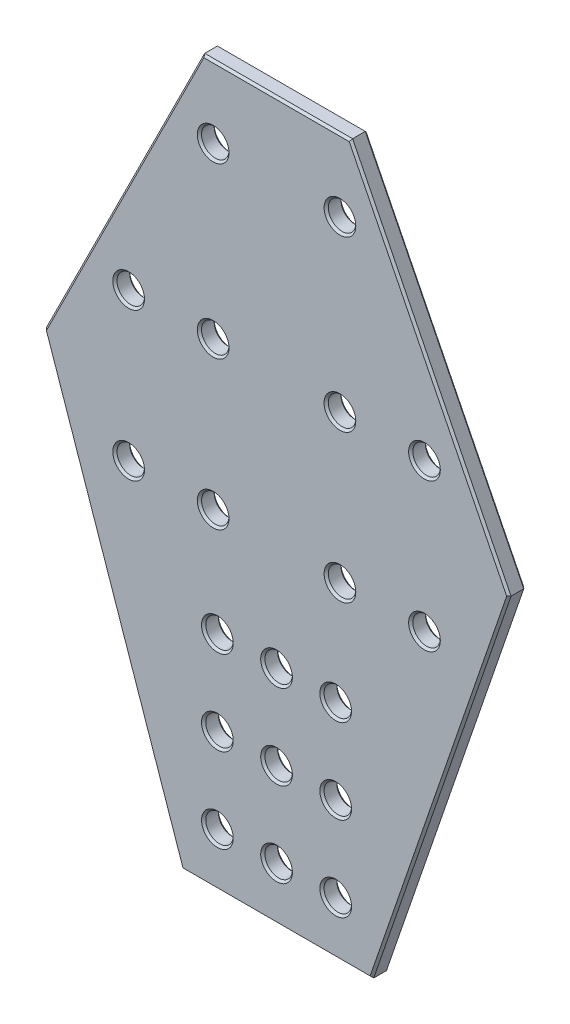
from build123d import *

# Parameters (mm, degrees)
SKETCH_1_R        = 13
EXTRUDE_874_DEPTH = 16
CHAMFER_1_SIZE    = 2


with BuildPart() as part:
    # 草图1 → Extrude 874 (new body)
    with BuildSketch(Plane.XY):
        Polygon((-70, 228), (70, 228), (220, -72), (90, -450), (-90, -450), (-220, -72), align=None)
        with Locations((-140, 0)):
            Circle(SKETCH_1_R, mode=Mode.SUBTRACT)
        with Locations((-60, 0)):
            Circle(SKETCH_1_R, mode=Mode.SUBTRACT)
        with Locations(Location((60, -140, 0), (0, 0, 180))):
            Circle(SKETCH_1_R, mode=Mode.SUBTRACT)
        with Locations(Location((140, -140, 0), (0, 0, 180))):
            Circle(SKETCH_1_R, mode=Mode.SUBTRACT)
        with Locations((-140, -140)):
            Circle(SKETCH_1_R, mode=Mode.SUBTRACT)
        with Locations((-60, -140)):
            Circle(SKETCH_1_R, mode=Mode.SUBTRACT)
        with Locations(Location((60, 0, 0), (0, 0, 180))):
            Circle(SKETCH_1_R, mode=Mode.SUBTRACT)
        with Locations(Location((140, 0, 0), (0, 0, 180))):
            Circle(SKETCH_1_R, mode=Mode.SUBTRACT)
        with Locations((0, -400)):
            Circle(SKETCH_1_R, mode=Mode.SUBTRACT)
        with Locations((0, -240)):
            Circle(SKETCH_1_R, mode=Mode.SUBTRACT)
        with Locations((60, 160)):
            Circle(SKETCH_1_R, mode=Mode.SUBTRACT)
        with Locations((0, -320)):
            Circle(SKETCH_1_R, mode=Mode.SUBTRACT)
        with Locations((-60, 160)):
            Circle(SKETCH_1_R, mode=Mode.SUBTRACT)
        with Locations((56, -240)):
            Circle(SKETCH_1_R, mode=Mode.SUBTRACT)
        with Locations((56, -320)):
            Circle(SKETCH_1_R, mode=Mode.SUBTRACT)
        with Locations((56, -400)):
            Circle(SKETCH_1_R, mode=Mode.SUBTRACT)
        with Locations(Location((-56, -400, 0), (0, 0, 180))):
            Circle(SKETCH_1_R, mode=Mode.SUBTRACT)
        with Locations(Location((-56, -320, 0), (0, 0, 180))):
            Circle(SKETCH_1_R, mode=Mode.SUBTRACT)
        with Locations(Location((-56, -240, 0), (0, 0, 180))):
            Circle(SKETCH_1_R, mode=Mode.SUBTRACT)
    extrude(amount=EXTRUDE_874_DEPTH)

    # 倒角1
    chamfer_1_edges = [part.edges().sort_by_distance(p)[0] for p in [
        (0, -450, 16),
        (155, -261, 16),
        (145, 78, 16),
        (-153, 0, 0),
        (-153, 0, 16),
        (0, 228, 16),
        (-73, 0, 0),
        (-73, 0, 16),
        (73, -140, 0),
        (73, -140, 16),
        (153, -140, 0),
        (153, -140, 16),
        (-153, -140, 0),
        (-153, -140, 16),
        (-73, -140, 0),
        (-73, -140, 16),
        (73, 0, 0),
        (73, 0, 16),
        (-145, 78, 16),
        (153, 0, 0),
        (153, 0, 16),
        (-13, -400, 0),
        (-13, -400, 16),
        (-13, -240, 0),
        (-13, -240, 16),
        (-13, -320, 0),
        (-13, -320, 16),
        (47, 160, 0),
        (47, 160, 16),
        (0, 228, 0),
        (-73, 160, 0),
        (-73, 160, 16),
        (145, 78, 0),
        (43, -240, 0),
        (43, -240, 16),
        (155, -261, 0),
        (43, -320, 0),
        (43, -320, 16),
        (-155, -261, 16),
        (0, -450, 0),
        (43, -400, 0),
        (43, -400, 16),
        (-155, -261, 0),
        (-43, -400, 0),
        (-43, -400, 16),
        (-145, 78, 0),
        (-43, -320, 0),
        (-43, -320, 16),
        (-43, -240, 0),
        (-43, -240, 16),
    ]]
    chamfer(chamfer_1_edges, length=CHAMFER_1_SIZE)


solid = part.part
